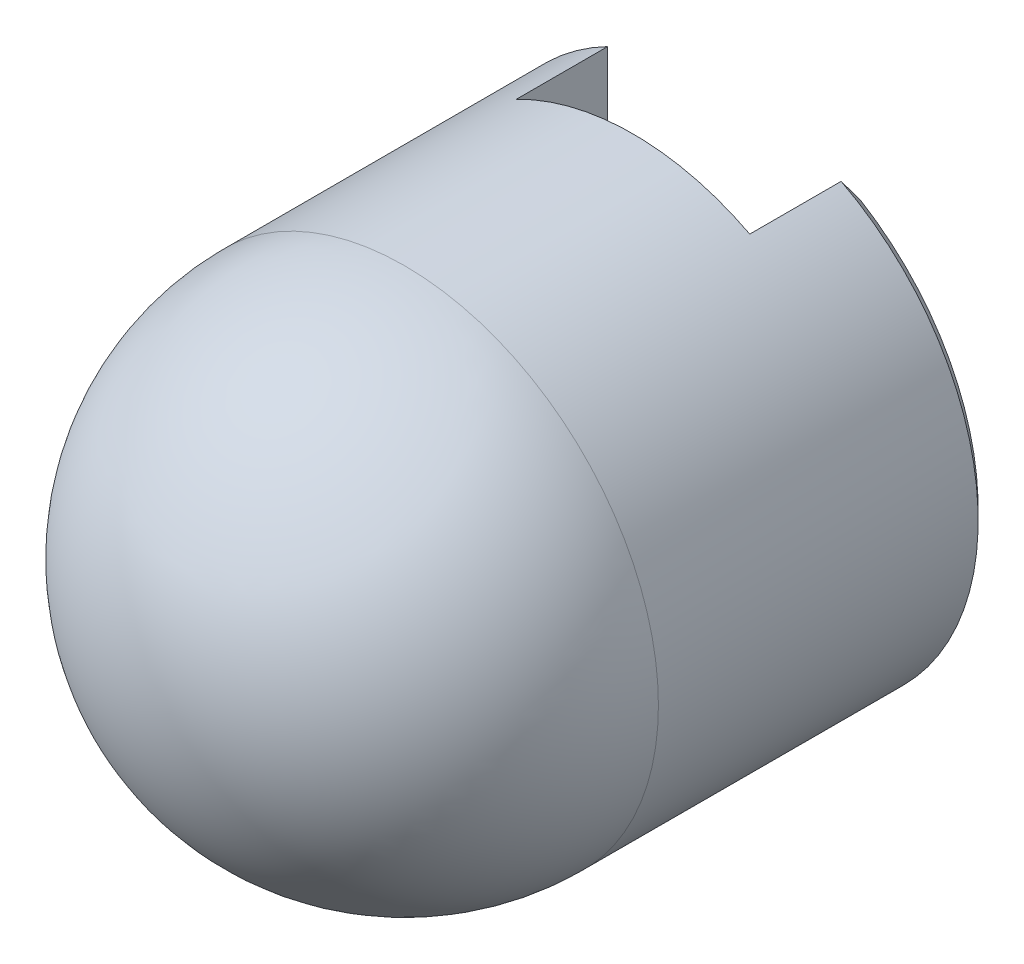
from build123d import *

# Parameters (mm, degrees)
SKETCH1_R           = 5
BOSS_EXTRUDE1_DEPTH = 11.5
FILLET1_R           = 5
SKETCH4_W           = 4.6
SKETCH4_H           = 15
CUT_EXTRUDE1_DEPTH  = 2
CHAMFER1_SIZE       = 0.2


with BuildPart() as part:
    # Sketch1 → Boss-Extrude1 (new body)
    with BuildSketch(Plane.XY):
        Circle(SKETCH1_R)
    extrude(amount=BOSS_EXTRUDE1_DEPTH)

    # Fillet1
    fillet1_edges = [part.edges().sort_by_distance(p)[0] for p in [
        (-5, 0, 11.5),
    ]]
    fillet(fillet1_edges, radius=FILLET1_R)

    # Sketch4 → Cut-Extrude1 (cut)
    with BuildSketch(Plane(origin=(0, 0, 0), x_dir=(-1, 0, 0), z_dir=(0, 0, -1))):
        Rectangle(SKETCH4_W, SKETCH4_H)
    extrude(amount=-CUT_EXTRUDE1_DEPTH, mode=Mode.SUBTRACT)

    # Chamfer1
    chamfer1_edges = [part.edges().sort_by_distance(p)[0] for p in [
        (-5, 0, 0),
        (4.272001873, 2.598076211, 0),
        (-2.3, 0, 0),
        (2.3, 0, 0),
    ]]
    chamfer(chamfer1_edges, length=CHAMFER1_SIZE)


solid = part.part
